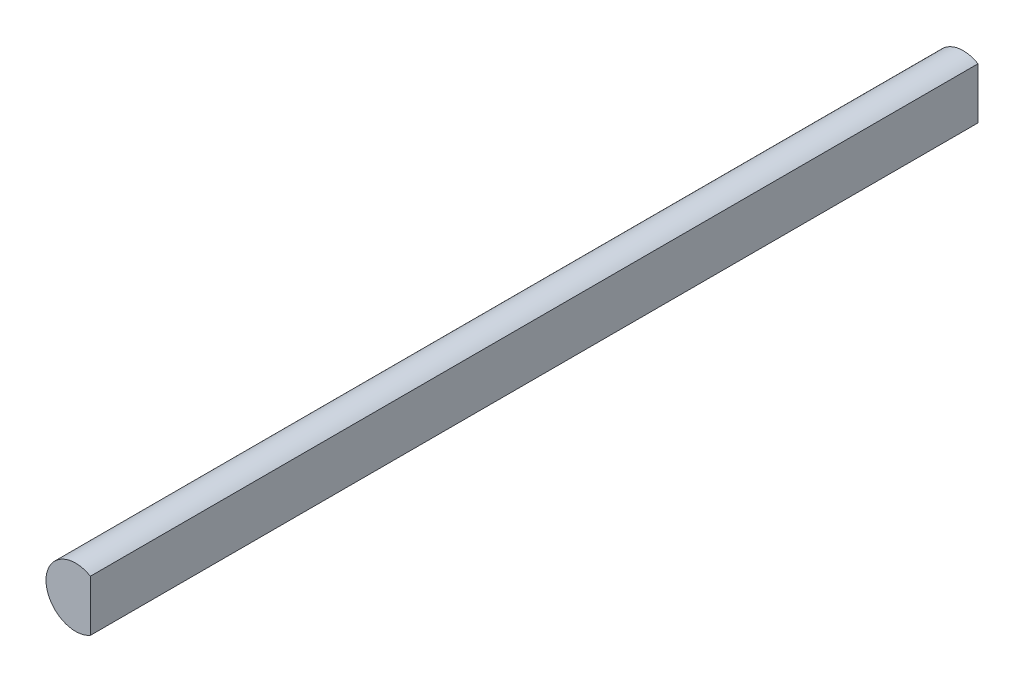
from build123d import *

# Parameters (mm, degrees)
EXTRUDE_1_DEPTH = 30


with BuildPart() as part:
    # 草图1 → 凸台-拉伸1 (new, symmetric)
    with BuildSketch(Plane.XY):
        with BuildLine():
            Line((1, 1.732050808), (1, -1.732050808))
            ThreePointArc((1, -1.732050808), (-2, 0), (1, 1.732050808))
        make_face()
    extrude(amount=EXTRUDE_1_DEPTH, both=True)


solid = part.part
